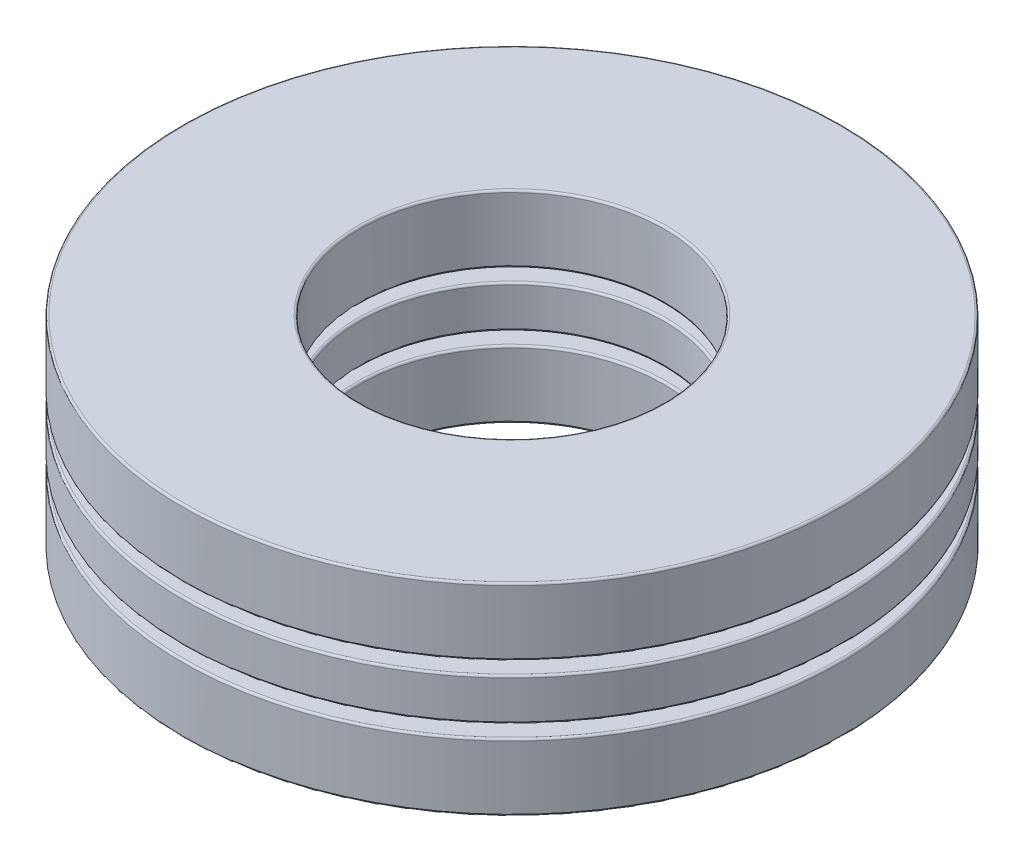
from build123d import *

# Parameters (mm, degrees)
SKETCH1_W         = 5.55625
SKETCH1_H         = 1.317625
CIRPATTERN1_COUNT = 8
CIRPATTERN1_ANGLE = 315
CIRPATTERN2_COUNT = 8
SKETCH4_W         = 5.55625
SKETCH4_H         = 2.1082
FILLET1_R         = 0.063246
FILLET2_R         = 0.063246
FILLET3_R         = 0.063246


with BuildPart() as part:
    # Sketch1 → Revolve1 (revolve)
    with BuildSketch(Plane(origin=(0, 0, 0), x_dir=(0, 0, -1), z_dir=(1, 0, 0)), mode=Mode.PRIVATE) as revolve1_sk:
        with Locations((-7.540625, 0)):
            Rectangle(SKETCH1_W, SKETCH1_H)
    revolve(revolve1_sk.sketch.rotate(Axis((0, -3.1623, 0), (0, 1, 0)), 180), axis=Axis((0, -3.1623, 0), (0, 1, 0)))

    # Sketch3 → Cut-Revolve1 (revolve, cut)
    with BuildSketch(Plane(origin=(0, 0, 0), x_dir=(0, 0, -1), z_dir=(1, 0, 0))):
        with BuildLine():
            Line((-7.540625, 1.0541), (-7.540625, -1.0541))
            ThreePointArc((-7.540625, -1.0541), (-8.594725, 0), (-7.540625, 1.0541))
        make_face()
    cut_revolve1 = revolve(axis=Axis((0, 1.0541, 7.540625), (0, -1, 0)), mode=Mode.SUBTRACT)

    # CirPattern2: Cut-Revolve1 ×8 about axis
    cirpattern2_axis = Axis((0, 0, 0), (0, 1, 0))
    for i in range(1, CIRPATTERN2_COUNT):
        add(cut_revolve1.rotate(cirpattern2_axis, i * 360 / CIRPATTERN2_COUNT), mode=Mode.SUBTRACT)

    # Fillet2
    fillet2_edges = [part.edges().sort_by_distance(p)[0] for p in [
        (0, 0.6588125, 10.31875),
        (0, 0.6588125, 4.7625),
        (0, -0.6588125, 4.7625),
        (0, -0.6588125, 10.31875),
    ]]
    fillet(fillet2_edges, radius=FILLET2_R)


with BuildPart() as body_2:
    # Sketch2 → Revolve2 (revolve)
    with BuildSketch(Plane(origin=(0, 0, 0), x_dir=(0, 0, -1), z_dir=(1, 0, 0))):
        with BuildLine():
            Line((-7.540625, 1.0541), (-7.540625, -1.0541))
            ThreePointArc((-7.540625, -1.0541), (-8.594725, 0), (-7.540625, 1.0541))
        make_face()
    revolve(axis=Axis((0, 1.0541, 7.540625), (0, -1, 0)))


with BuildPart() as cirpattern1_1:
    # CirPattern1: pattern copy
    add(body_2.part.rotate(Axis((0, 3.1623, 0), (0, -1, 0)), 1 * CIRPATTERN1_ANGLE / (CIRPATTERN1_COUNT - 1)))


with BuildPart() as cirpattern1_2:
    # CirPattern1: pattern copy
    add(body_2.part.rotate(Axis((0, 3.1623, 0), (0, -1, 0)), 2 * CIRPATTERN1_ANGLE / (CIRPATTERN1_COUNT - 1)))


with BuildPart() as cirpattern1_3:
    # CirPattern1: pattern copy
    add(body_2.part.rotate(Axis((0, 3.1623, 0), (0, -1, 0)), 3 * CIRPATTERN1_ANGLE / (CIRPATTERN1_COUNT - 1)))


with BuildPart() as cirpattern1_4:
    # CirPattern1: pattern copy
    add(body_2.part.rotate(Axis((0, 3.1623, 0), (0, -1, 0)), 4 * CIRPATTERN1_ANGLE / (CIRPATTERN1_COUNT - 1)))


with BuildPart() as cirpattern1_5:
    # CirPattern1: pattern copy
    add(body_2.part.rotate(Axis((0, 3.1623, 0), (0, -1, 0)), 5 * CIRPATTERN1_ANGLE / (CIRPATTERN1_COUNT - 1)))


with BuildPart() as cirpattern1_6:
    # CirPattern1: pattern copy
    add(body_2.part.rotate(Axis((0, 3.1623, 0), (0, -1, 0)), 6 * CIRPATTERN1_ANGLE / (CIRPATTERN1_COUNT - 1)))


with BuildPart() as cirpattern1_7:
    # CirPattern1: pattern copy
    add(body_2.part.rotate(Axis((0, 3.1623, 0), (0, -1, 0)), 7 * CIRPATTERN1_ANGLE / (CIRPATTERN1_COUNT - 1)))


with BuildPart() as body_10:
    # Sketch4 → Revolve3 (revolve)
    with BuildSketch(Plane(origin=(0, 0, 0), x_dir=(0, 0, -1), z_dir=(1, 0, 0)), mode=Mode.PRIVATE) as revolve3_sk:
        with Locations((-7.540625, 2.1082)):
            Rectangle(SKETCH4_W, SKETCH4_H)
        with Locations((-7.540625, -2.1082)):
            Rectangle(SKETCH4_W, SKETCH4_H)
    revolve(revolve3_sk.sketch.rotate(Axis((0, -3.1623, 0), (0, 1, 0)), 180), axis=Axis((0, -3.1623, 0), (0, 1, 0)))

    # Fillet1
    fillet1_edges = [body_10.edges().sort_by_distance(p)[0] for p in [
        (0, 1.0541, 10.31875),
        (0, 1.0541, 4.7625),
        (0, 3.1623, 4.7625),
        (0, 3.1623, 10.31875),
    ]]
    fillet(fillet1_edges, radius=FILLET1_R)

    # Fillet3
    fillet3_edges = [body_10.edges().sort_by_distance(p)[0] for p in [
        (0, -3.1623, 10.31875),
        (0, -3.1623, 4.7625),
        (0, -1.0541, 4.7625),
        (0, -1.0541, 10.31875),
    ]]
    fillet(fillet3_edges, radius=FILLET3_R)


solid = Compound([part.part, body_2.part, cirpattern1_1.part, cirpattern1_2.part, cirpattern1_3.part, cirpattern1_4.part, cirpattern1_5.part, cirpattern1_6.part, cirpattern1_7.part, body_10.part])
